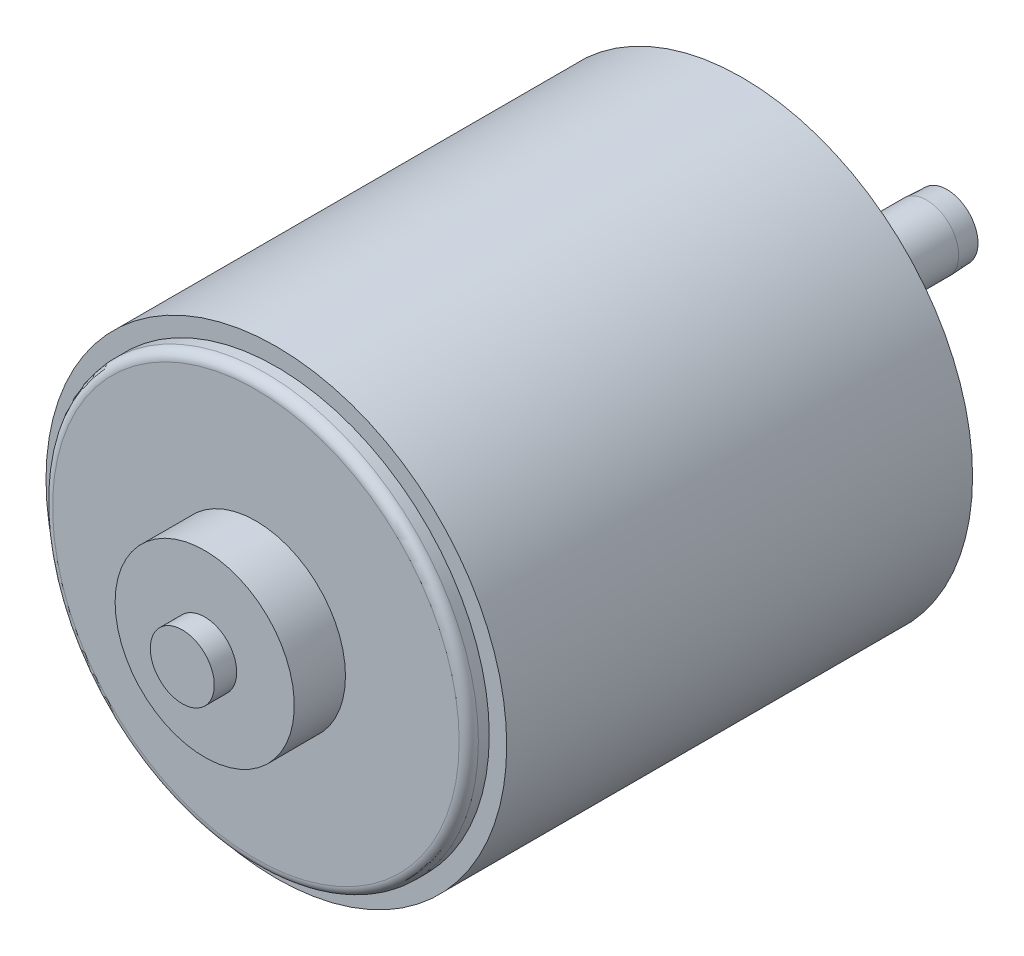
from build123d import *

# Parameters (mm, degrees)
SKETCH1_R                 = 18
BOSS_EXTRUDE1_DEPTH       = 38
BOSS_EXTRUDE2_DEPTH       = 16
BOSS_EXTRUDE2_DEPTH_BACK  = 45
SKETCH2_R                 = 2.5
SKETCH3_R                 = 7
BOSS_EXTRUDE3_DEPTH       = 4
M3X0_5_TAPPED_HOLE1_D     = 2.5
M3X0_5_TAPPED_HOLE1_DEPTH = 3
M3X0_5_TAPPED_HOLE1_TIP   = 0.751075774
SKETCH6_R                 = 2.5
CUT_EXTRUDE1_DEPTH        = 1.25
CUT_EXTRUDE2_START        = -1.6
SKETCH7_R                 = 18
SKETCH7_R_2               = 16.635
CUT_EXTRUDE2_DEPTH        = 1.6
FILLET1_R                 = 0.75


with BuildPart() as part:
    # Sketch1 → Boss-Extrude1 (new body)
    with BuildSketch(Plane.XY):
        Circle(SKETCH1_R)
    extrude(amount=BOSS_EXTRUDE1_DEPTH)

    # Sketch2 → Boss-Extrude2 (add, two sides: drawn at the far end of the back side and taken through both)
    with BuildSketch(Plane(origin=(0, 0, 0), x_dir=(-1, 0, 0), z_dir=(0, 0, -1)).offset(-BOSS_EXTRUDE2_DEPTH_BACK)):
        Circle(SKETCH2_R)
    extrude(amount=BOSS_EXTRUDE2_DEPTH + BOSS_EXTRUDE2_DEPTH_BACK)

    # Sketch3 → Boss-Extrude3 (add)
    with BuildSketch(Plane(origin=(0, 0, 0), x_dir=(-1, 0, 0), z_dir=(0, 0, -1))):
        with Locations(Location((0, 0, 0), (0, 0, 180))):
            Circle(SKETCH3_R)
    boss_extrude3 = extrude(amount=BOSS_EXTRUDE3_DEPTH)

    # M3x0.5 Tapped Hole1
    with Locations(Plane(origin=(0, 0, 0), x_dir=(-1, 0, 0), z_dir=(0, 0, -1))):
        with Locations((0, 12.5), (-10.825317547, 6.25), (0, -12.5), (10.825317547, 6.25)):
            Hole(M3X0_5_TAPPED_HOLE1_D / 2, depth=M3X0_5_TAPPED_HOLE1_DEPTH)
            with Locations((0, 0, -(M3X0_5_TAPPED_HOLE1_DEPTH + M3X0_5_TAPPED_HOLE1_TIP / 2))):  # 118° drill point
                Cone(0, M3X0_5_TAPPED_HOLE1_D / 2, M3X0_5_TAPPED_HOLE1_TIP, mode=Mode.SUBTRACT)

    # Sketch6 → Cut-Extrude1 (cut)
    with BuildSketch(Plane.XY.offset(45)):
        with Locations(Location((0, 0, 0), (0, 0, 180))):
            Circle(SKETCH6_R)
    extrude(amount=-CUT_EXTRUDE1_DEPTH, mode=Mode.SUBTRACT)

    # Mirror1: Boss-Extrude3 across plane
    add(boss_extrude3.mirror(Plane(origin=(0, 0, 19), x_dir=(1, 0, 0), z_dir=(0, 0, -1))))

    # Sketch7 → Cut-Extrude2 (cut)
    with BuildSketch(Plane.XY.offset(38).offset(CUT_EXTRUDE2_START)):
        Circle(SKETCH7_R)
        Circle(SKETCH7_R_2, mode=Mode.SUBTRACT)
    extrude(amount=CUT_EXTRUDE2_DEPTH, mode=Mode.SUBTRACT)

    # Fillet1
    fillet1_edges = [part.edges().sort_by_distance(p)[0] for p in [
        (-16.635, 0, 38),
    ]]
    fillet(fillet1_edges, radius=FILLET1_R)

    # Sketch8 → Cut-Revolve1 (revolve, cut)
    with BuildSketch(Plane(origin=(0, 0, 0), x_dir=(1, 0, 0), z_dir=(0, 1, 0)), mode=Mode.PRIVATE) as cut_revolve1_sk:
        Polygon((2.5, 16), (2.5, 14.4125), (2.4238, 16), align=None)
    revolve(cut_revolve1_sk.sketch.rotate(Axis((0, 0, -16), (0, 0, -1)), 180), axis=Axis((0, 0, -16), (0, 0, -1)), mode=Mode.SUBTRACT)


solid = part.part
